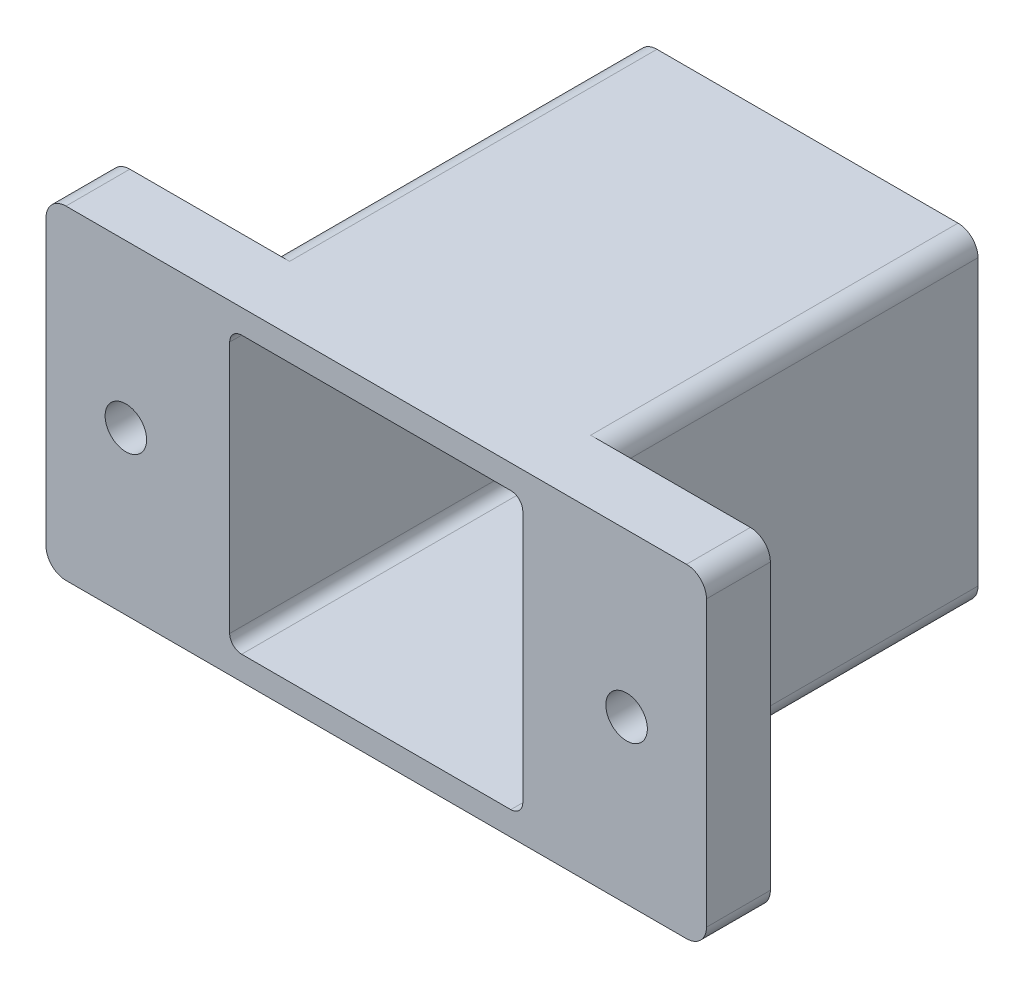
from build123d import *

# Parameters (mm, degrees)
SKETCH_1_W          = 42.7
SKETCH_1_H          = 40.6
SKETCH_1_W_2        = 36.7
SKETCH_1_H_2        = 34.6
EXTRUDE_1_DEPTH     = 50
SKETCH_2_W          = 42.7
SKETCH_2_H          = 40.6
SKETCH_2_R          = 7.5
EXTRUDE_2_DEPTH     = 4
SKETCH_3_W          = 20
SKETCH_3_H          = 40.6
EXTRUDE_3_DEPTH     = 8
SKETCH_4_R          = 2.6
CUT_EXTRUDE_1_DEPTH = 71.978253712
CUT_EXTRUDE_2_DEPTH = 4
FILLET_1_R          = 2.5
FILLET_2_R          = 1.5


with BuildPart() as part:
    # Эскиз1 → Бобышка-Вытянуть1 (new body)
    with BuildSketch(Plane.XY):
        Rectangle(SKETCH_1_W, SKETCH_1_H)
        Rectangle(SKETCH_1_W_2, SKETCH_1_H_2, mode=Mode.SUBTRACT)
    extrude(amount=EXTRUDE_1_DEPTH)

    # Эскиз2 → Бобышка-Вытянуть2 (add)
    with BuildSketch(Plane(origin=(0, 0, 0), x_dir=(-1, 0, 0), z_dir=(0, 0, -1))):
        Rectangle(SKETCH_2_W, SKETCH_2_H)
        Circle(SKETCH_2_R, mode=Mode.SUBTRACT)
    extrude(amount=EXTRUDE_2_DEPTH)

    # Эскиз3 → Бобышка-Вытянуть3 (add)
    with BuildSketch(Plane.XY.offset(50)):
        with Locations((-31.35, 0)):
            Rectangle(SKETCH_3_W, SKETCH_3_H)
    extrude_3 = extrude(amount=-EXTRUDE_3_DEPTH)

    # Эскиз4 → Вырез-Вытянуть1 (cut, through all)
    with BuildSketch(Plane.XY.offset(50)):
        with Locations((-31.35, 0)):
            Circle(SKETCH_4_R)
    cut_extrude_1 = extrude(amount=-CUT_EXTRUDE_1_DEPTH, mode=Mode.SUBTRACT)

    # Эскиз5 → Вырез-Вытянуть2 (cut)
    with BuildSketch(Plane(origin=(0, 0, 42), x_dir=(-1, 0, 0), z_dir=(0, 0, -1))):
        Polygon((36.084272207, 0), (33.717136104, 4.1), (28.982863896, 4.1), (26.615727793, 0), (28.982863896, -4.1), (33.717136104, -4.1), align=None)
    cut_extrude_2 = extrude(amount=-CUT_EXTRUDE_2_DEPTH, mode=Mode.SUBTRACT)

    # Зеркальное отражение1: Бобышка-Вытянуть3, Вырез-Вытянуть1, Вырез-Вытянуть2 across plane
    add(extrude_3.mirror(Plane(origin=(0, 0, 0), x_dir=(0, 0, 1), z_dir=(1, 0, 0))))
    add(cut_extrude_1.mirror(Plane(origin=(0, 0, 0), x_dir=(0, 0, 1), z_dir=(1, 0, 0))), mode=Mode.SUBTRACT)
    add(cut_extrude_2.mirror(Plane(origin=(0, 0, 0), x_dir=(0, 0, 1), z_dir=(1, 0, 0))), mode=Mode.SUBTRACT)

    # Скругление1
    fillet_1_edges = [part.edges().sort_by_distance(p)[0] for p in [
        (-21.35, 20.3, 19),
        (-21.35, -20.3, 19),
        (-41.35, -20.3, 46),
        (-41.35, 20.3, 46),
        (21.35, -20.3, 19),
        (21.35, 20.3, 19),
        (41.35, 20.3, 46),
        (41.35, -20.3, 46),
    ]]
    fillet(fillet_1_edges, radius=FILLET_1_R)

    # Скругление2
    fillet_2_edges = [part.edges().sort_by_distance(p)[0] for p in [
        (-18.35, 17.3, 25),
        (-18.35, -17.3, 25),
        (18.35, -17.3, 25),
        (18.35, 17.3, 25),
    ]]
    fillet(fillet_2_edges, radius=FILLET_2_R)


solid = part.part
